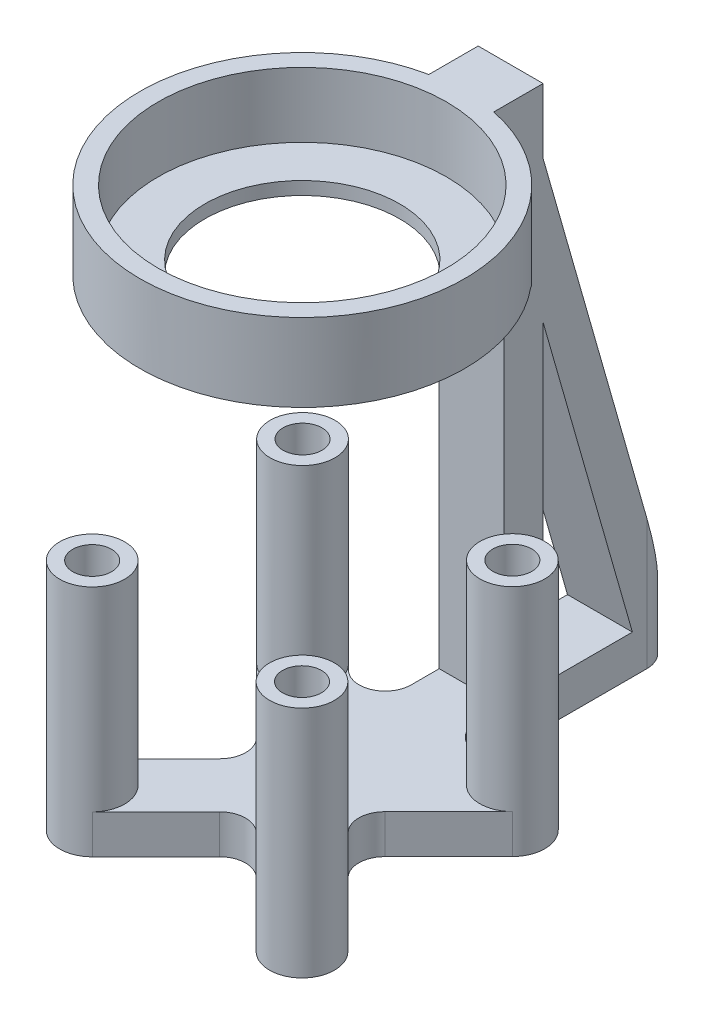
from build123d import *

# Parameters (mm, degrees)
SKETCH_1_R           = 1.5
EXTRUDE_1_DEPTH      = 3
SKETCH_2_R           = 2.5
SKETCH_2_R_2         = 1.5
EXTRUDE_2_DEPTH      = 15
SKETCH_3_W           = 5
SKETCH_3_H           = 3
EXTRUDE_3_DEPTH      = 35.032354187
EXTRUDE_4_DEPTH      = 5
SKETCH_5_R           = 12.5
SKETCH_5_R_2         = 7.5
EXTRUDE_5_DEPTH      = 1
SKETCH_6_R           = 12.5
SKETCH_6_R_2         = 11.1
EXTRUDE_6_DEPTH      = 5
EXTRUDE_7_DEPTH      = 5
EXTRUDE_7_DEPTH_BACK = 1
CHAMFER_1_SIZE       = 5
FILLET_1_R           = 2


with BuildPart() as part:
    # Эскиз1 → Бобышка-Вытянуть1 (new body)
    with BuildSketch(Plane(origin=(0, 0, 0), x_dir=(1, 0, 0), z_dir=(0, 1, 0))):
        with BuildLine():
            Line((-6.310049273, -9.865580478), (0, -3.539912271))
            Line((0, -3.539912271), (6.310049273, -9.865580478))
            ThreePointArc((6.310049273, -9.865580478), (9.845580478, -9.869950727), (9.849950727, -6.334419522))
            Line((9.849950727, -6.334419522), (3.531171747, 0))
            Line((3.531171747, 0), (9.849950727, 6.334419522))
            ThreePointArc((9.849950727, 6.334419522), (9.845580478, 9.869950727), (6.310049273, 9.865580478))
            Line((6.310049273, 9.865580478), (2.5, 6.04610039))
            Line((2.5, 6.04610039), (2.5, 26.04610039))
            Line((2.5, 26.04610039), (-2.5, 26.04610039))
            Line((-2.5, 26.04610039), (-2.5, 6.04610039))
            Line((-2.5, 6.04610039), (-6.310049273, 9.865580478))
            ThreePointArc((-6.310049273, 9.865580478), (-9.845580478, 9.869950727), (-9.849950727, 6.334419522))
            Line((-9.849950727, 6.334419522), (-3.531171747, 0))
            Line((-3.531171747, 0), (-9.849950727, -6.334419522))
            ThreePointArc((-9.849950727, -6.334419522), (-9.845580478, -9.869950727), (-6.310049273, -9.865580478))
        make_face()
        with Locations(Location((-8.08, 8.1, 0), (0, 0, 270))):
            Circle(SKETCH_1_R, mode=Mode.SUBTRACT)
        with Locations(Location((8.08, 8.1, 0), (0, 0, 270))):
            Circle(SKETCH_1_R, mode=Mode.SUBTRACT)
        with Locations(Location((-8.08, -8.1, 0), (0, 0, 270))):
            Circle(SKETCH_1_R, mode=Mode.SUBTRACT)
        with Locations(Location((8.08, -8.1, 0), (0, 0, 270))):
            Circle(SKETCH_1_R, mode=Mode.SUBTRACT)
    extrude(amount=EXTRUDE_1_DEPTH)

    # Эскиз2 → Бобышка-Вытянуть2 (add)
    # profile 1 of 4: a face of its own
    with BuildSketch(Plane(origin=(0, 3, 0), x_dir=(1, 0, 0), z_dir=(0, 1, 0))):
        with Locations(Location((-8.08, -8.1, 0), (0, 0, 135.07082293))):
            Circle(SKETCH_2_R)
        with Locations(Location((-8.08, -8.1, 0), (0, 0, 270))):
            Circle(SKETCH_2_R_2, mode=Mode.SUBTRACT)
    # profile 2 of 4: a face of its own
    with BuildSketch(Plane(origin=(0, 3, 0), x_dir=(1, 0, 0), z_dir=(0, 1, 0))):
        with Locations(Location((-8.08, 8.1, 0), (0, 0, 44.92917707))):
            Circle(SKETCH_2_R)
        with Locations(Location((-8.08, 8.1, 0), (0, 0, 270))):
            Circle(SKETCH_2_R_2, mode=Mode.SUBTRACT)
    # profile 3 of 4: a face of its own
    with BuildSketch(Plane(origin=(0, 3, 0), x_dir=(1, 0, 0), z_dir=(0, 1, 0))):
        with Locations(Location((8.08, 8.1, 0), (0, 0, 135.07082293))):
            Circle(SKETCH_2_R)
        with Locations(Location((8.08, 8.1, 0), (0, 0, 270))):
            Circle(SKETCH_2_R_2, mode=Mode.SUBTRACT)
    # profile 4 of 4: a face of its own
    with BuildSketch(Plane(origin=(0, 3, 0), x_dir=(1, 0, 0), z_dir=(0, 1, 0))):
        with Locations(Location((8.08, -8.1, 0), (0, 0, 44.92917707))):
            Circle(SKETCH_2_R)
        with Locations(Location((8.08, -8.1, 0), (0, 0, 270))):
            Circle(SKETCH_2_R_2, mode=Mode.SUBTRACT)
    extrude(amount=EXTRUDE_2_DEPTH)

    # Эскиз3 → Бобышка-Вытянуть3 (add)
    with BuildSketch(Plane(origin=(0, 3, 0), x_dir=(1, 0, 0), z_dir=(0, 1, 0))):
        with Locations((0, 14.54610039)):
            Rectangle(SKETCH_3_W, SKETCH_3_H)
    extrude(amount=EXTRUDE_3_DEPTH)

    # Эскиз4 → Бобышка-Вытянуть4 (add)
    with BuildSketch(Plane(origin=(2.5, 0, 0), x_dir=(0, 0, -1), z_dir=(1, 0, 0))):
        Polygon((16.04610039, 38.032354187), (26.04610039, 3), (22.926270675, 3), (16.04610039, 27.10285623), align=None)
    extrude(amount=-EXTRUDE_4_DEPTH)



with BuildPart() as body_2:
    # Эскиз5 → Бобышка-Вытянуть5 (new body)
    with BuildSketch(Plane(origin=(0, 38.032354187, 0), x_dir=(1, 0, 0), z_dir=(0, 1, 0))):
        with Locations(Location((0, 0, 0), (0, 0, 270))):
            Circle(SKETCH_5_R)
        with Locations(Location((0, 0, 0), (0, 0, 270))):
            Circle(SKETCH_5_R_2, mode=Mode.SUBTRACT)
    extrude(amount=-EXTRUDE_5_DEPTH)

    # Эскиз6 → Бобышка-Вытянуть6 (add)
    with BuildSketch(Plane(origin=(0, 38.032354187, 0), x_dir=(1, 0, 0), z_dir=(0, 1, 0))):
        with Locations(Location((0, 0, 0), (0, 0, 270))):
            Circle(SKETCH_6_R)
        with Locations(Location((0, 0, 0), (0, 0, 270))):
            Circle(SKETCH_6_R_2, mode=Mode.SUBTRACT)
    extrude(amount=EXTRUDE_6_DEPTH)


with BuildPart() as part_1:
    add(part.part)

    add(body_2.part)  # Бобышка-Вытянуть7 merges body 2
    # Эскиз7 → Бобышка-Вытянуть7 (add, two sides: drawn at the far end of the back side and taken through both)
    with BuildSketch(Plane(origin=(0, 38.032354187, 0), x_dir=(1, 0, 0), z_dir=(0, 1, 0)).offset(-EXTRUDE_7_DEPTH_BACK)):
        with BuildLine():
            Line((-2.5, 16.04610039), (2.5, 16.04610039))
            Line((2.5, 16.04610039), (2.5, 12.247448714))
            ThreePointArc((2.5, 12.247448714), (0, 12.5), (-2.5, 12.247448714))
            Line((-2.5, 12.247448714), (-2.5, 16.04610039))
        make_face()
    extrude(amount=EXTRUDE_7_DEPTH + EXTRUDE_7_DEPTH_BACK)

    # Фаска1
    chamfer_1_edges = [part_1.edges().sort_by_distance(p)[0] for p in [
        (0, 37.032354187, -13.04610039),
    ]]
    chamfer(chamfer_1_edges, length=CHAMFER_1_SIZE)

    # Скругление1
    fillet_1_edges = [part_1.edges().sort_by_distance(p)[0] for p in [
        (-3.531171747, 1.5, 0),
        (-2.5, 1.5, -6.04610039),
        (-2.5, 1.5, -26.04610039),
        (2.5, 1.5, -26.04610039),
        (2.5, 1.5, -6.04610039),
        (3.531171747, 1.5, 0),
        (0, 1.5, 3.539912271),
    ]]
    fillet(fillet_1_edges, radius=FILLET_1_R)


solid = part_1.part
